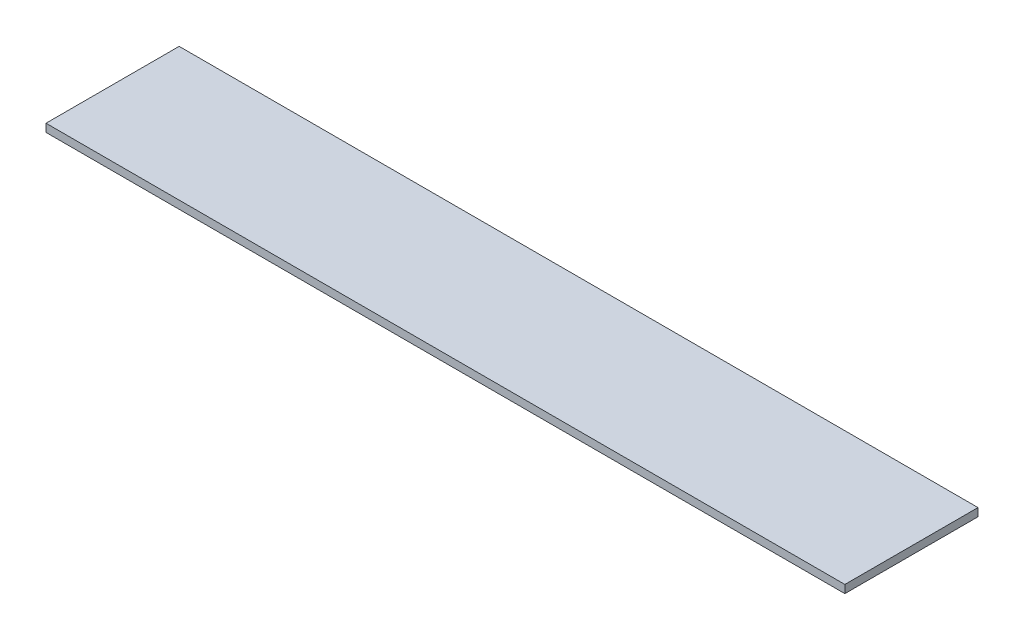
from build123d import *

# Parameters (mm, degrees)
SKETCH_1_W      = 300
SKETCH_1_H      = 50
EXTRUDE_1_DEPTH = 3


with BuildPart() as part:
    # 草图1 → 凸台-拉伸1 (new body)
    with BuildSketch(Plane(origin=(0, 0, 0), x_dir=(1, 0, 0), z_dir=(0, 1, 0))):
        Rectangle(SKETCH_1_W, SKETCH_1_H)
    extrude(amount=EXTRUDE_1_DEPTH)


solid = part.part
